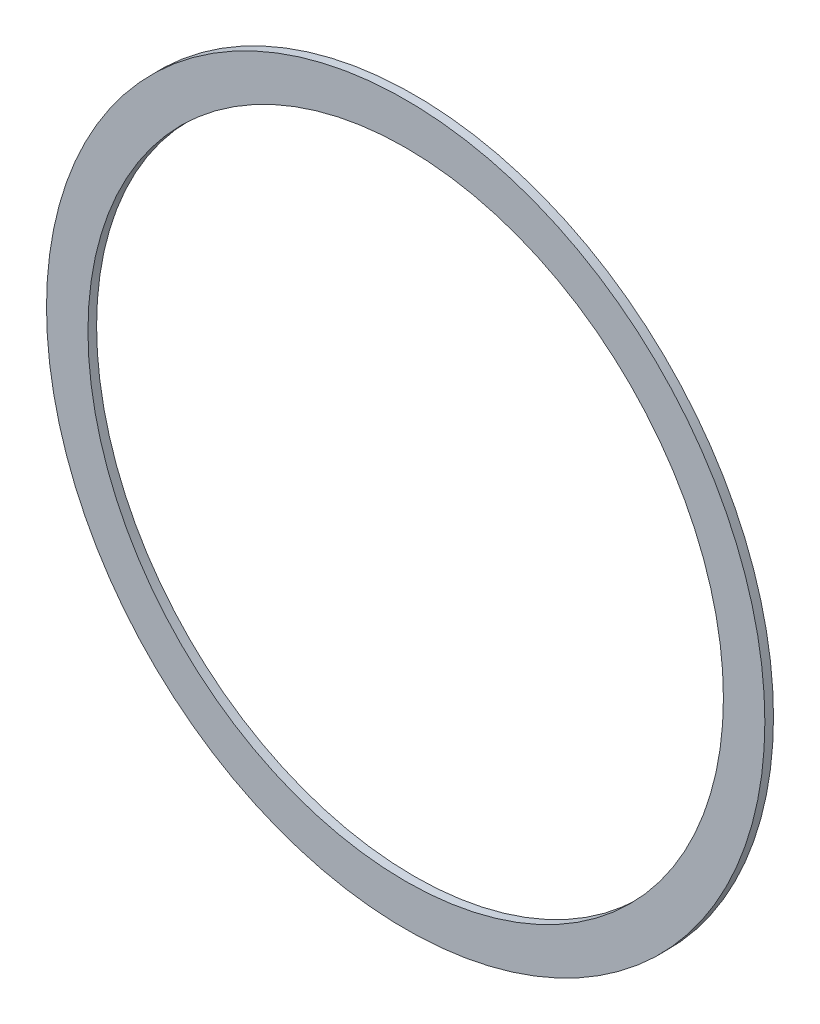
from build123d import *

# Parameters (mm, degrees)
SKETCH2_R           = 116.84
BOSS_EXTRUDE1_DEPTH = 1.5875


with BuildPart() as part:
    # Sketch2 → Boss-Extrude1 (new, symmetric)
    with BuildSketch(Plane.XY):
        with BuildLine():
            ThreePointArc((-1.651, 128.513680847), (-113.44208216, 64.09028885), (-116.977106193, -64.886930424))
            ThreePointArc((-116.977106193, -64.886930424), (-116.59127356, -65.61727077), (-116.200881143, -66.345183954))
            ThreePointArc((-116.200881143, -66.345183954), (-115.806084025, -67.070386581), (-115.406761019, -67.793106963))
            ThreePointArc((-115.406761019, -67.793106963), (0, -135.636), (115.406761019, -67.793106963))
            ThreePointArc((115.406761019, -67.793106963), (115.804512811, -67.073251299), (116.197774523, -66.350932884))
            ThreePointArc((116.197774523, -66.350932884), (116.589738292, -65.620154913), (116.977106193, -64.886930424))
            ThreePointArc((116.977106193, -64.886930424), (113.44208216, 64.09028885), (1.651, 128.513680847))
            ThreePointArc((1.651, 128.513680847), (0.825516124, 128.521420187), (0, 128.524))
            ThreePointArc((0, 128.524), (-0.825516124, 128.521420187), (-1.651, 128.513680847))
        make_face()
        with Locations((0, -3.556)):
            Circle(SKETCH2_R, mode=Mode.SUBTRACT)
    extrude(amount=BOSS_EXTRUDE1_DEPTH, both=True)


solid = part.part
